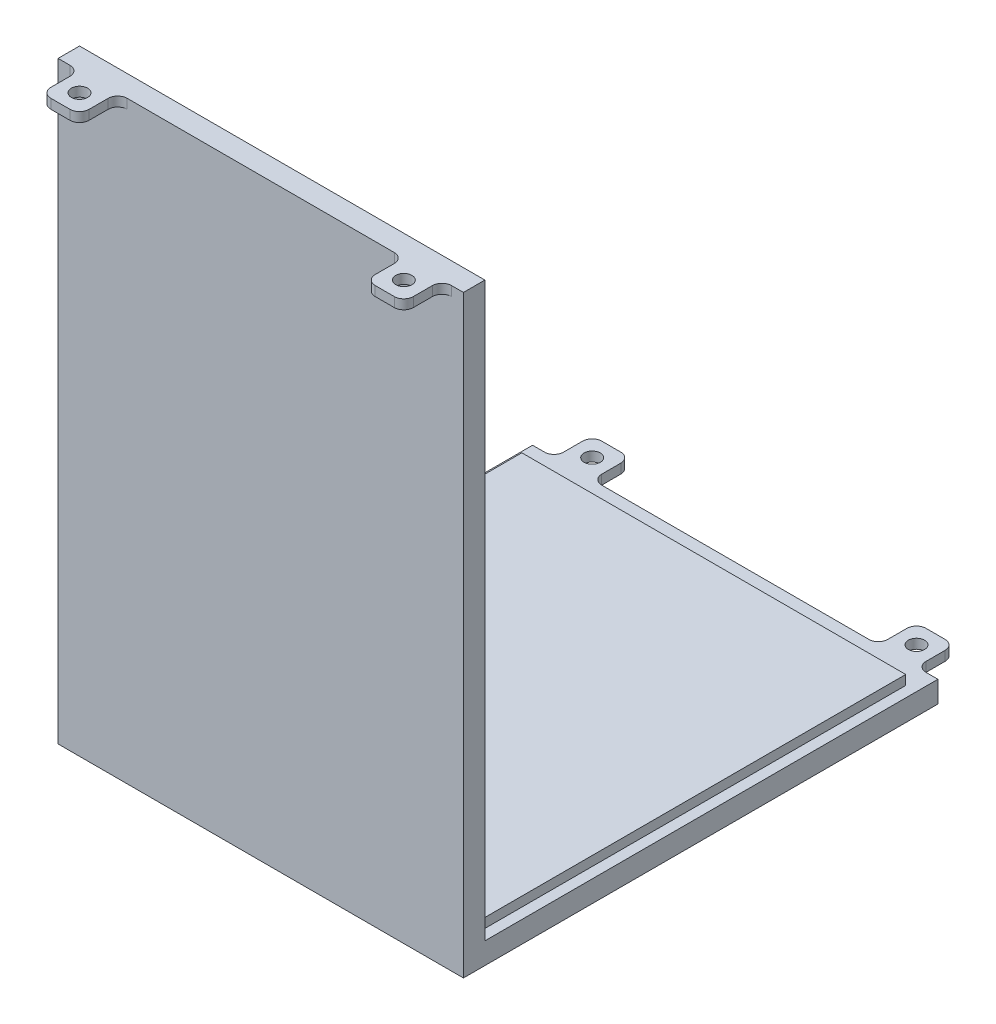
from build123d import *

# Parameters (mm, degrees)
SKETCH1_W               = 124.5
SKETCH1_H               = 85
BOSS_EXTRUDE1_DEPTH     = 4.5
SKETCH2_W               = 85
SKETCH2_H               = 4.5
BOSS_EXTRUDE2_DEPTH     = 95
SKETCH3_W               = 80.5
SKETCH3_H               = 2
BOSS_EXTRUDE3_DEPTH     = 90.5
SKETCH4_W               = 8
SKETCH4_H               = 2
BOSS_EXTRUDE4_DEPTH     = 8
SKETCH5_W               = 8
SKETCH5_H               = 2
BOSS_EXTRUDE5_DEPTH     = 8
CUT_EXTRUDE1_DEPTH      = 183.576696213
CUT_EXTRUDE1_DEPTH_BACK = 183.576696213
SKETCH6_R               = 1.7
FILLET1_R               = 2


with BuildPart() as part:
    # Sketch1 → Boss-Extrude1 (new body)
    with BuildSketch(Plane(origin=(0, 0, 0), x_dir=(0, 1, 0), z_dir=(0, 0, 1))):
        with Locations((62.25, 42.5)):
            Rectangle(SKETCH1_W, SKETCH1_H)
    extrude(amount=BOSS_EXTRUDE1_DEPTH)

    # Sketch2 → Boss-Extrude2 (add)
    with BuildSketch(Plane(origin=(0, 0, 0), x_dir=(1, 0, 0), z_dir=(0, 0, -1))):
        with Locations((-42.5, -2.25)):
            Rectangle(SKETCH2_W, SKETCH2_H)
    extrude(amount=BOSS_EXTRUDE2_DEPTH)

    # Sketch3 → Boss-Extrude3 (add)
    with BuildSketch(Plane(origin=(0, 0, 0), x_dir=(1, 0, 0), z_dir=(0, 0, -1))):
        with Locations((-42.5, -5.5)):
            Rectangle(SKETCH3_W, SKETCH3_H)
    extrude(amount=BOSS_EXTRUDE3_DEPTH)

    # Sketch4 → Boss-Extrude4 (add)
    with BuildSketch(Plane.XY.offset(4.5)):
        with Locations((-76.5, 123.5)):
            Rectangle(SKETCH4_W, SKETCH4_H)
        with Locations((-8.5, 123.5)):
            Rectangle(SKETCH4_W, SKETCH4_H)
    extrude(amount=BOSS_EXTRUDE4_DEPTH)

    # Sketch5 → Boss-Extrude5 (add)
    with BuildSketch(Plane(origin=(0, 0, -95), x_dir=(1, 0, 0), z_dir=(0, 0, -1))):
        with Locations((-76.5, -3.5)):
            Rectangle(SKETCH5_W, SKETCH5_H)
        with Locations((-8.5, -3.5)):
            Rectangle(SKETCH5_W, SKETCH5_H)
    extrude(amount=BOSS_EXTRUDE5_DEPTH)

    # Sketch6 → Cut-Extrude1 (cut, two sides: drawn at the far end of the back side and taken through both)
    with BuildSketch(Plane(origin=(0, 124.5, 0), x_dir=(-1, 0, 0), z_dir=(0, 1, 0)).offset(-CUT_EXTRUDE1_DEPTH_BACK)):
        with Locations(Location((8.5, 8.5, 0), (0, 0, 90))):
            Circle(SKETCH6_R)
        with Locations(Location((76.5, 8.5, 0), (0, 0, 90))):
            Circle(SKETCH6_R)
        with Locations(Location((76.5, -99, 0), (0, 0, 90))):
            Circle(SKETCH6_R)
        with Locations(Location((8.5, -99, 0), (0, 0, 90))):
            Circle(SKETCH6_R)
    extrude(amount=CUT_EXTRUDE1_DEPTH + CUT_EXTRUDE1_DEPTH_BACK, mode=Mode.SUBTRACT)

    # Fillet1
    fillet1_edges = [part.edges().sort_by_distance(p)[0] for p in [
        (-80.5, 123.5, 4.5),
        (-72.5, 123.5, 4.5),
        (-80.5, 123.5, 12.5),
        (-72.5, 123.5, 12.5),
        (-4.5, 123.5, 4.5),
        (-12.5, 123.5, 4.5),
        (-4.5, 123.5, 12.5),
        (-12.5, 123.5, 12.5),
        (-80.5, 3.5, -95),
        (-72.5, 3.5, -95),
        (-80.5, 3.5, -103),
        (-72.5, 3.5, -103),
        (-4.5, 3.5, -95),
        (-12.5, 3.5, -95),
        (-4.5, 3.5, -103),
        (-12.5, 3.5, -103),
    ]]
    fillet(fillet1_edges, radius=FILLET1_R)


solid = part.part
